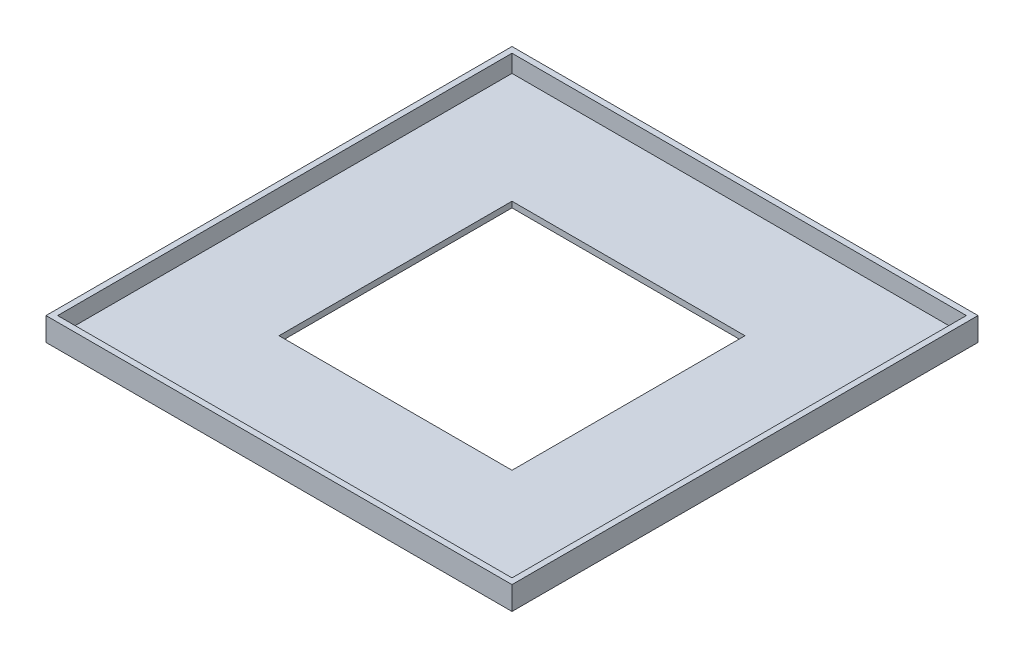
from build123d import *

# Parameters (mm, degrees)
SKETCH1_W           = 200
SKETCH1_H           = 200
BOSS_EXTRUDE1_DEPTH = 10
SHELL1_T            = -2.5
SKETCH2_W           = 100
SKETCH2_H           = 100
CUT_EXTRUDE1_DEPTH  = 142.620090383


with BuildPart() as part:
    # Sketch1 → Boss-Extrude1 (new body)
    with BuildSketch(Plane(origin=(0, 0, 0), x_dir=(1, 0, 0), z_dir=(0, 1, 0))):
        Rectangle(SKETCH1_W, SKETCH1_H)
    extrude(amount=BOSS_EXTRUDE1_DEPTH)

    # Shell1
    shell1_openings = [part.faces().sort_by_distance(p)[0] for p in [
        (0, 10, 0),
    ]]
    offset(amount=SHELL1_T, openings=shell1_openings, kind=Kind.INTERSECTION)

    # Sketch2 → Cut-Extrude1 (cut, through all)
    with BuildSketch(Plane(origin=(0, 2.5, 0), x_dir=(1, 0, 0), z_dir=(0, 1, 0))):
        Rectangle(SKETCH2_W, SKETCH2_H)
    extrude(amount=-CUT_EXTRUDE1_DEPTH, mode=Mode.SUBTRACT)


solid = part.part
